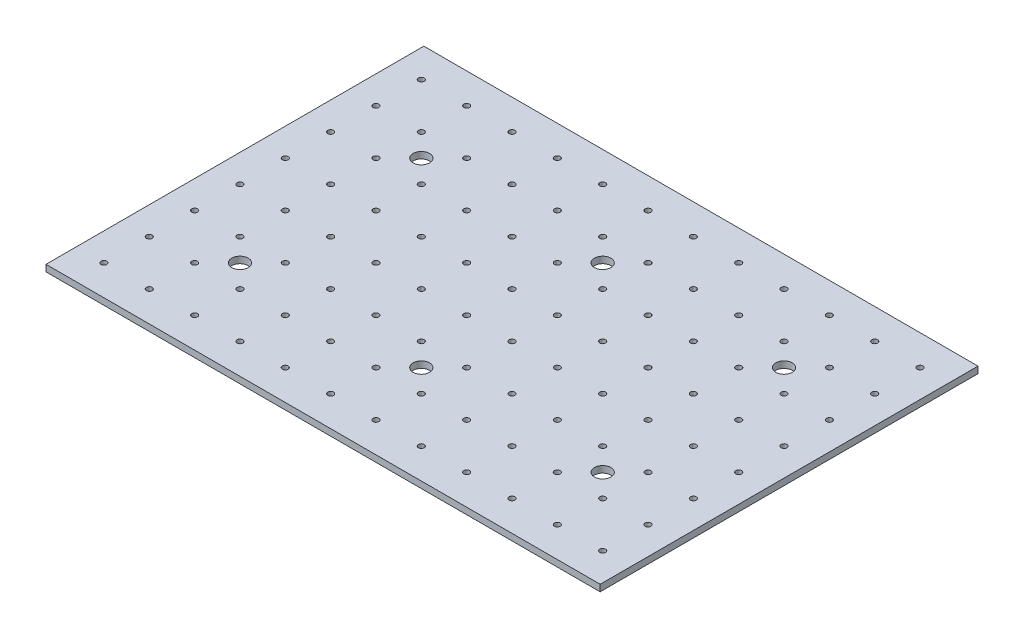
from build123d import *

# Parameters (mm, degrees)
SKETCH1_W                = 110
SKETCH1_H                = 75
BOSS_EXTRUDE1_DEPTH      = 0.65
SKETCH2_R                = 0.575
CUT_EXTRUDE2_DEPTH       = 67.570808167
LPATTERN1_COUNT          = 6
LPATTERN1_PITCH          = 9
LPATTERN1_COUNT_DIR2     = 4
LPATTERN1_PITCH_DIR2     = 9
MIRROR1_COPY_1_SKETCH_R  = 0.575
MIRROR1_COPY_1_DEPTH     = 67.570808167
MIRROR1_COPY_2_SKETCH_R  = 0.575
MIRROR1_COPY_2_DEPTH     = 67.570808167
MIRROR1_COPY_3_SKETCH_R  = 0.575
MIRROR1_COPY_3_DEPTH     = 67.570808167
MIRROR1_COPY_4_SKETCH_R  = 0.575
MIRROR1_COPY_4_DEPTH     = 67.570808167
MIRROR1_COPY_5_SKETCH_R  = 0.575
MIRROR1_COPY_5_DEPTH     = 67.570808167
MIRROR1_COPY_6_SKETCH_R  = 0.575
MIRROR1_COPY_6_DEPTH     = 67.570808167
MIRROR1_COPY_7_SKETCH_R  = 0.575
MIRROR1_COPY_7_DEPTH     = 67.570808167
MIRROR1_COPY_8_SKETCH_R  = 0.575
MIRROR1_COPY_8_DEPTH     = 67.570808167
MIRROR1_COPY_9_SKETCH_R  = 0.575
MIRROR1_COPY_9_DEPTH     = 67.570808167
MIRROR1_COPY_10_SKETCH_R = 0.575
MIRROR1_COPY_10_DEPTH    = 67.570808167
MIRROR1_COPY_11_SKETCH_R = 0.575
MIRROR1_COPY_11_DEPTH    = 67.570808167
MIRROR1_COPY_12_SKETCH_R = 0.575
MIRROR1_COPY_12_DEPTH    = 67.570808167
MIRROR1_COPY_13_SKETCH_R = 0.575
MIRROR1_COPY_13_DEPTH    = 67.570808167
MIRROR1_COPY_14_SKETCH_R = 0.575
MIRROR1_COPY_14_DEPTH    = 67.570808167
MIRROR1_COPY_15_SKETCH_R = 0.575
MIRROR1_COPY_15_DEPTH    = 67.570808167
MIRROR1_COPY_16_SKETCH_R = 0.575
MIRROR1_COPY_16_DEPTH    = 67.570808167
MIRROR1_COPY_17_SKETCH_R = 0.575
MIRROR1_COPY_17_DEPTH    = 67.570808167
MIRROR1_COPY_18_SKETCH_R = 0.575
MIRROR1_COPY_18_DEPTH    = 67.570808167
MIRROR1_COPY_19_SKETCH_R = 0.575
MIRROR1_COPY_19_DEPTH    = 67.570808167
MIRROR1_COPY_20_SKETCH_R = 0.575
MIRROR1_COPY_20_DEPTH    = 67.570808167
MIRROR1_COPY_21_SKETCH_R = 0.575
MIRROR1_COPY_21_DEPTH    = 67.570808167
MIRROR1_COPY_22_SKETCH_R = 0.575
MIRROR1_COPY_22_DEPTH    = 67.570808167
MIRROR1_COPY_23_SKETCH_R = 0.575
MIRROR1_COPY_23_DEPTH    = 67.570808167
MIRROR2_COPY_1_SKETCH_R  = 0.575
MIRROR2_COPY_1_DEPTH     = 67.570808167
MIRROR2_COPY_2_SKETCH_R  = 0.575
MIRROR2_COPY_2_DEPTH     = 67.570808167
MIRROR2_COPY_3_SKETCH_R  = 0.575
MIRROR2_COPY_3_DEPTH     = 67.570808167
MIRROR2_COPY_4_SKETCH_R  = 0.575
MIRROR2_COPY_4_DEPTH     = 67.570808167
MIRROR2_COPY_5_SKETCH_R  = 0.575
MIRROR2_COPY_5_DEPTH     = 67.570808167
MIRROR2_COPY_6_SKETCH_R  = 0.575
MIRROR2_COPY_6_DEPTH     = 67.570808167
MIRROR2_COPY_7_SKETCH_R  = 0.575
MIRROR2_COPY_7_DEPTH     = 67.570808167
MIRROR2_COPY_8_SKETCH_R  = 0.575
MIRROR2_COPY_8_DEPTH     = 67.570808167
MIRROR2_COPY_9_SKETCH_R  = 0.575
MIRROR2_COPY_9_DEPTH     = 67.570808167
MIRROR2_COPY_10_SKETCH_R = 0.575
MIRROR2_COPY_10_DEPTH    = 67.570808167
MIRROR2_COPY_11_SKETCH_R = 0.575
MIRROR2_COPY_11_DEPTH    = 67.570808167
MIRROR2_COPY_12_SKETCH_R = 0.575
MIRROR2_COPY_12_DEPTH    = 67.570808167
MIRROR2_COPY_13_SKETCH_R = 0.575
MIRROR2_COPY_13_DEPTH    = 67.570808167
MIRROR2_COPY_14_SKETCH_R = 0.575
MIRROR2_COPY_14_DEPTH    = 67.570808167
MIRROR2_COPY_15_SKETCH_R = 0.575
MIRROR2_COPY_15_DEPTH    = 67.570808167
MIRROR2_COPY_16_SKETCH_R = 0.575
MIRROR2_COPY_16_DEPTH    = 67.570808167
MIRROR2_COPY_17_SKETCH_R = 0.575
MIRROR2_COPY_17_DEPTH    = 67.570808167
MIRROR2_COPY_18_SKETCH_R = 0.575
MIRROR2_COPY_18_DEPTH    = 67.570808167
MIRROR2_COPY_19_SKETCH_R = 0.575
MIRROR2_COPY_19_DEPTH    = 67.570808167
MIRROR2_COPY_20_SKETCH_R = 0.575
MIRROR2_COPY_20_DEPTH    = 67.570808167
MIRROR2_COPY_21_SKETCH_R = 0.575
MIRROR2_COPY_21_DEPTH    = 67.570808167
MIRROR2_COPY_22_SKETCH_R = 0.575
MIRROR2_COPY_22_DEPTH    = 67.570808167
MIRROR2_COPY_23_SKETCH_R = 0.575
MIRROR2_COPY_23_DEPTH    = 67.570808167
MIRROR2_COPY_24_SKETCH_R = 0.575
MIRROR2_COPY_24_DEPTH    = 67.570808167
MIRROR2_COPY_25_SKETCH_R = 0.575
MIRROR2_COPY_25_DEPTH    = 67.570808167
MIRROR2_COPY_26_SKETCH_R = 0.575
MIRROR2_COPY_26_DEPTH    = 67.570808167
MIRROR2_COPY_27_SKETCH_R = 0.575
MIRROR2_COPY_27_DEPTH    = 67.570808167
MIRROR2_COPY_28_SKETCH_R = 0.575
MIRROR2_COPY_28_DEPTH    = 67.570808167
MIRROR2_COPY_29_SKETCH_R = 0.575
MIRROR2_COPY_29_DEPTH    = 67.570808167
MIRROR2_COPY_30_SKETCH_R = 0.575
MIRROR2_COPY_30_DEPTH    = 67.570808167
MIRROR2_COPY_31_SKETCH_R = 0.575
MIRROR2_COPY_31_DEPTH    = 67.570808167
MIRROR2_COPY_32_SKETCH_R = 0.575
MIRROR2_COPY_32_DEPTH    = 67.570808167
MIRROR2_COPY_33_SKETCH_R = 0.575
MIRROR2_COPY_33_DEPTH    = 67.570808167
MIRROR2_COPY_34_SKETCH_R = 0.575
MIRROR2_COPY_34_DEPTH    = 67.570808167
MIRROR2_COPY_35_SKETCH_R = 0.575
MIRROR2_COPY_35_DEPTH    = 67.570808167
MIRROR2_COPY_36_SKETCH_R = 0.575
MIRROR2_COPY_36_DEPTH    = 67.570808167
MIRROR2_COPY_37_SKETCH_R = 0.575
MIRROR2_COPY_37_DEPTH    = 67.570808167
MIRROR2_COPY_38_SKETCH_R = 0.575
MIRROR2_COPY_38_DEPTH    = 67.570808167
MIRROR2_COPY_39_SKETCH_R = 0.575
MIRROR2_COPY_39_DEPTH    = 67.570808167
MIRROR2_COPY_40_SKETCH_R = 0.575
MIRROR2_COPY_40_DEPTH    = 67.570808167
MIRROR2_COPY_41_SKETCH_R = 0.575
MIRROR2_COPY_41_DEPTH    = 67.570808167
MIRROR2_COPY_42_SKETCH_R = 0.575
MIRROR2_COPY_42_DEPTH    = 67.570808167
MIRROR2_COPY_43_SKETCH_R = 0.575
MIRROR2_COPY_43_DEPTH    = 67.570808167
MIRROR2_COPY_44_SKETCH_R = 0.575
MIRROR2_COPY_44_DEPTH    = 67.570808167
MIRROR2_COPY_45_SKETCH_R = 0.575
MIRROR2_COPY_45_DEPTH    = 67.570808167
MIRROR2_COPY_46_SKETCH_R = 0.575
MIRROR2_COPY_46_DEPTH    = 67.570808167
MIRROR2_COPY_47_SKETCH_R = 0.575
MIRROR2_COPY_47_DEPTH    = 67.570808167
F_4_CLEARANCE_HOLE1_D    = 3.2639


with BuildPart() as part:
    # Sketch1 → Boss-Extrude1 (new, symmetric)
    with BuildSketch(Plane(origin=(0, 0, 0), x_dir=(1, 0, 0), z_dir=(0, 1, 0))):
        Rectangle(SKETCH1_W, SKETCH1_H)
    extrude(amount=BOSS_EXTRUDE1_DEPTH, both=True)

    # Sketch2 → Cut-Extrude2 (cut, symmetric)
    with BuildSketch(Plane(origin=(0, 0, 0), x_dir=(1, 0, 0), z_dir=(0, 1, 0))):
        with Locations((-4.5, 4.5)):
            Circle(SKETCH2_R)
    cut_extrude2 = extrude(amount=CUT_EXTRUDE2_DEPTH, both=True, mode=Mode.SUBTRACT)

    # LPattern1: Cut-Extrude2 6 × 4
    with Locations(*[(-i * LPATTERN1_PITCH, 0, -j * LPATTERN1_PITCH_DIR2) for i in range(LPATTERN1_COUNT) for j in range(LPATTERN1_COUNT_DIR2) if (i, j) != (0, 0)]):
        add(cut_extrude2, mode=Mode.SUBTRACT)

    # Mirror1: Cut-Extrude2 across plane
    add(cut_extrude2.mirror(Plane.XY), mode=Mode.SUBTRACT)

    # Mirror1 copy 1 sketch → Mirror1 copy 1 (cut, symmetric)
    with BuildSketch(Plane(origin=(0, 0, 9), x_dir=(1, 0, 0), z_dir=(0, 1, 0))):
        with Locations((-4.5, -4.5)):
            Circle(MIRROR1_COPY_1_SKETCH_R)
    extrude(amount=MIRROR1_COPY_1_DEPTH, both=True, mode=Mode.SUBTRACT)

    # Mirror1 copy 2 sketch → Mirror1 copy 2 (cut, symmetric)
    with BuildSketch(Plane(origin=(0, 0, 18), x_dir=(1, 0, 0), z_dir=(0, 1, 0))):
        with Locations((-4.5, -4.5)):
            Circle(MIRROR1_COPY_2_SKETCH_R)
    extrude(amount=MIRROR1_COPY_2_DEPTH, both=True, mode=Mode.SUBTRACT)

    # Mirror1 copy 3 sketch → Mirror1 copy 3 (cut, symmetric)
    with BuildSketch(Plane(origin=(0, 0, 27), x_dir=(1, 0, 0), z_dir=(0, 1, 0))):
        with Locations((-4.5, -4.5)):
            Circle(MIRROR1_COPY_3_SKETCH_R)
    extrude(amount=MIRROR1_COPY_3_DEPTH, both=True, mode=Mode.SUBTRACT)

    # Mirror1 copy 4 sketch → Mirror1 copy 4 (cut, symmetric)
    with BuildSketch(Plane(origin=(-9, 0, 0), x_dir=(1, 0, 0), z_dir=(0, 1, 0))):
        with Locations((-4.5, -4.5)):
            Circle(MIRROR1_COPY_4_SKETCH_R)
    extrude(amount=MIRROR1_COPY_4_DEPTH, both=True, mode=Mode.SUBTRACT)

    # Mirror1 copy 5 sketch → Mirror1 copy 5 (cut, symmetric)
    with BuildSketch(Plane(origin=(-9, 0, 9), x_dir=(1, 0, 0), z_dir=(0, 1, 0))):
        with Locations((-4.5, -4.5)):
            Circle(MIRROR1_COPY_5_SKETCH_R)
    extrude(amount=MIRROR1_COPY_5_DEPTH, both=True, mode=Mode.SUBTRACT)

    # Mirror1 copy 6 sketch → Mirror1 copy 6 (cut, symmetric)
    with BuildSketch(Plane(origin=(-9, 0, 18), x_dir=(1, 0, 0), z_dir=(0, 1, 0))):
        with Locations((-4.5, -4.5)):
            Circle(MIRROR1_COPY_6_SKETCH_R)
    extrude(amount=MIRROR1_COPY_6_DEPTH, both=True, mode=Mode.SUBTRACT)

    # Mirror1 copy 7 sketch → Mirror1 copy 7 (cut, symmetric)
    with BuildSketch(Plane(origin=(-9, 0, 27), x_dir=(1, 0, 0), z_dir=(0, 1, 0))):
        with Locations((-4.5, -4.5)):
            Circle(MIRROR1_COPY_7_SKETCH_R)
    extrude(amount=MIRROR1_COPY_7_DEPTH, both=True, mode=Mode.SUBTRACT)

    # Mirror1 copy 8 sketch → Mirror1 copy 8 (cut, symmetric)
    with BuildSketch(Plane(origin=(-18, 0, 0), x_dir=(1, 0, 0), z_dir=(0, 1, 0))):
        with Locations((-4.5, -4.5)):
            Circle(MIRROR1_COPY_8_SKETCH_R)
    extrude(amount=MIRROR1_COPY_8_DEPTH, both=True, mode=Mode.SUBTRACT)

    # Mirror1 copy 9 sketch → Mirror1 copy 9 (cut, symmetric)
    with BuildSketch(Plane(origin=(-18, 0, 9), x_dir=(1, 0, 0), z_dir=(0, 1, 0))):
        with Locations((-4.5, -4.5)):
            Circle(MIRROR1_COPY_9_SKETCH_R)
    extrude(amount=MIRROR1_COPY_9_DEPTH, both=True, mode=Mode.SUBTRACT)

    # Mirror1 copy 10 sketch → Mirror1 copy 10 (cut, symmetric)
    with BuildSketch(Plane(origin=(-18, 0, 18), x_dir=(1, 0, 0), z_dir=(0, 1, 0))):
        with Locations((-4.5, -4.5)):
            Circle(MIRROR1_COPY_10_SKETCH_R)
    extrude(amount=MIRROR1_COPY_10_DEPTH, both=True, mode=Mode.SUBTRACT)

    # Mirror1 copy 11 sketch → Mirror1 copy 11 (cut, symmetric)
    with BuildSketch(Plane(origin=(-18, 0, 27), x_dir=(1, 0, 0), z_dir=(0, 1, 0))):
        with Locations((-4.5, -4.5)):
            Circle(MIRROR1_COPY_11_SKETCH_R)
    extrude(amount=MIRROR1_COPY_11_DEPTH, both=True, mode=Mode.SUBTRACT)

    # Mirror1 copy 12 sketch → Mirror1 copy 12 (cut, symmetric)
    with BuildSketch(Plane(origin=(-27, 0, 0), x_dir=(1, 0, 0), z_dir=(0, 1, 0))):
        with Locations((-4.5, -4.5)):
            Circle(MIRROR1_COPY_12_SKETCH_R)
    extrude(amount=MIRROR1_COPY_12_DEPTH, both=True, mode=Mode.SUBTRACT)

    # Mirror1 copy 13 sketch → Mirror1 copy 13 (cut, symmetric)
    with BuildSketch(Plane(origin=(-27, 0, 9), x_dir=(1, 0, 0), z_dir=(0, 1, 0))):
        with Locations((-4.5, -4.5)):
            Circle(MIRROR1_COPY_13_SKETCH_R)
    extrude(amount=MIRROR1_COPY_13_DEPTH, both=True, mode=Mode.SUBTRACT)

    # Mirror1 copy 14 sketch → Mirror1 copy 14 (cut, symmetric)
    with BuildSketch(Plane(origin=(-27, 0, 18), x_dir=(1, 0, 0), z_dir=(0, 1, 0))):
        with Locations((-4.5, -4.5)):
            Circle(MIRROR1_COPY_14_SKETCH_R)
    extrude(amount=MIRROR1_COPY_14_DEPTH, both=True, mode=Mode.SUBTRACT)

    # Mirror1 copy 15 sketch → Mirror1 copy 15 (cut, symmetric)
    with BuildSketch(Plane(origin=(-27, 0, 27), x_dir=(1, 0, 0), z_dir=(0, 1, 0))):
        with Locations((-4.5, -4.5)):
            Circle(MIRROR1_COPY_15_SKETCH_R)
    extrude(amount=MIRROR1_COPY_15_DEPTH, both=True, mode=Mode.SUBTRACT)

    # Mirror1 copy 16 sketch → Mirror1 copy 16 (cut, symmetric)
    with BuildSketch(Plane(origin=(-36, 0, 0), x_dir=(1, 0, 0), z_dir=(0, 1, 0))):
        with Locations((-4.5, -4.5)):
            Circle(MIRROR1_COPY_16_SKETCH_R)
    extrude(amount=MIRROR1_COPY_16_DEPTH, both=True, mode=Mode.SUBTRACT)

    # Mirror1 copy 17 sketch → Mirror1 copy 17 (cut, symmetric)
    with BuildSketch(Plane(origin=(-36, 0, 9), x_dir=(1, 0, 0), z_dir=(0, 1, 0))):
        with Locations((-4.5, -4.5)):
            Circle(MIRROR1_COPY_17_SKETCH_R)
    extrude(amount=MIRROR1_COPY_17_DEPTH, both=True, mode=Mode.SUBTRACT)

    # Mirror1 copy 18 sketch → Mirror1 copy 18 (cut, symmetric)
    with BuildSketch(Plane(origin=(-36, 0, 18), x_dir=(1, 0, 0), z_dir=(0, 1, 0))):
        with Locations((-4.5, -4.5)):
            Circle(MIRROR1_COPY_18_SKETCH_R)
    extrude(amount=MIRROR1_COPY_18_DEPTH, both=True, mode=Mode.SUBTRACT)

    # Mirror1 copy 19 sketch → Mirror1 copy 19 (cut, symmetric)
    with BuildSketch(Plane(origin=(-36, 0, 27), x_dir=(1, 0, 0), z_dir=(0, 1, 0))):
        with Locations((-4.5, -4.5)):
            Circle(MIRROR1_COPY_19_SKETCH_R)
    extrude(amount=MIRROR1_COPY_19_DEPTH, both=True, mode=Mode.SUBTRACT)

    # Mirror1 copy 20 sketch → Mirror1 copy 20 (cut, symmetric)
    with BuildSketch(Plane(origin=(-45, 0, 0), x_dir=(1, 0, 0), z_dir=(0, 1, 0))):
        with Locations((-4.5, -4.5)):
            Circle(MIRROR1_COPY_20_SKETCH_R)
    extrude(amount=MIRROR1_COPY_20_DEPTH, both=True, mode=Mode.SUBTRACT)

    # Mirror1 copy 21 sketch → Mirror1 copy 21 (cut, symmetric)
    with BuildSketch(Plane(origin=(-45, 0, 9), x_dir=(1, 0, 0), z_dir=(0, 1, 0))):
        with Locations((-4.5, -4.5)):
            Circle(MIRROR1_COPY_21_SKETCH_R)
    extrude(amount=MIRROR1_COPY_21_DEPTH, both=True, mode=Mode.SUBTRACT)

    # Mirror1 copy 22 sketch → Mirror1 copy 22 (cut, symmetric)
    with BuildSketch(Plane(origin=(-45, 0, 18), x_dir=(1, 0, 0), z_dir=(0, 1, 0))):
        with Locations((-4.5, -4.5)):
            Circle(MIRROR1_COPY_22_SKETCH_R)
    extrude(amount=MIRROR1_COPY_22_DEPTH, both=True, mode=Mode.SUBTRACT)

    # Mirror1 copy 23 sketch → Mirror1 copy 23 (cut, symmetric)
    with BuildSketch(Plane(origin=(-45, 0, 27), x_dir=(1, 0, 0), z_dir=(0, 1, 0))):
        with Locations((-4.5, -4.5)):
            Circle(MIRROR1_COPY_23_SKETCH_R)
    extrude(amount=MIRROR1_COPY_23_DEPTH, both=True, mode=Mode.SUBTRACT)

    # Mirror2: Cut-Extrude2 across plane
    add(cut_extrude2.mirror(Plane(origin=(0, 0, 0), x_dir=(0, 0, 1), z_dir=(1, 0, 0))), mode=Mode.SUBTRACT)

    # Mirror2 copy 1 sketch → Mirror2 copy 1 (cut, symmetric)
    with BuildSketch(Plane(origin=(0, 0, -9), x_dir=(-1, 0, 0), z_dir=(0, 1, 0))):
        with Locations((-4.5, -4.5)):
            Circle(MIRROR2_COPY_1_SKETCH_R)
    extrude(amount=MIRROR2_COPY_1_DEPTH, both=True, mode=Mode.SUBTRACT)

    # Mirror2 copy 2 sketch → Mirror2 copy 2 (cut, symmetric)
    with BuildSketch(Plane(origin=(0, 0, -18), x_dir=(-1, 0, 0), z_dir=(0, 1, 0))):
        with Locations((-4.5, -4.5)):
            Circle(MIRROR2_COPY_2_SKETCH_R)
    extrude(amount=MIRROR2_COPY_2_DEPTH, both=True, mode=Mode.SUBTRACT)

    # Mirror2 copy 3 sketch → Mirror2 copy 3 (cut, symmetric)
    with BuildSketch(Plane(origin=(0, 0, -27), x_dir=(-1, 0, 0), z_dir=(0, 1, 0))):
        with Locations((-4.5, -4.5)):
            Circle(MIRROR2_COPY_3_SKETCH_R)
    extrude(amount=MIRROR2_COPY_3_DEPTH, both=True, mode=Mode.SUBTRACT)

    # Mirror2 copy 4 sketch → Mirror2 copy 4 (cut, symmetric)
    with BuildSketch(Plane(origin=(9, 0, 0), x_dir=(-1, 0, 0), z_dir=(0, 1, 0))):
        with Locations((-4.5, -4.5)):
            Circle(MIRROR2_COPY_4_SKETCH_R)
    extrude(amount=MIRROR2_COPY_4_DEPTH, both=True, mode=Mode.SUBTRACT)

    # Mirror2 copy 5 sketch → Mirror2 copy 5 (cut, symmetric)
    with BuildSketch(Plane(origin=(9, 0, -9), x_dir=(-1, 0, 0), z_dir=(0, 1, 0))):
        with Locations((-4.5, -4.5)):
            Circle(MIRROR2_COPY_5_SKETCH_R)
    extrude(amount=MIRROR2_COPY_5_DEPTH, both=True, mode=Mode.SUBTRACT)

    # Mirror2 copy 6 sketch → Mirror2 copy 6 (cut, symmetric)
    with BuildSketch(Plane(origin=(9, 0, -18), x_dir=(-1, 0, 0), z_dir=(0, 1, 0))):
        with Locations((-4.5, -4.5)):
            Circle(MIRROR2_COPY_6_SKETCH_R)
    extrude(amount=MIRROR2_COPY_6_DEPTH, both=True, mode=Mode.SUBTRACT)

    # Mirror2 copy 7 sketch → Mirror2 copy 7 (cut, symmetric)
    with BuildSketch(Plane(origin=(9, 0, -27), x_dir=(-1, 0, 0), z_dir=(0, 1, 0))):
        with Locations((-4.5, -4.5)):
            Circle(MIRROR2_COPY_7_SKETCH_R)
    extrude(amount=MIRROR2_COPY_7_DEPTH, both=True, mode=Mode.SUBTRACT)

    # Mirror2 copy 8 sketch → Mirror2 copy 8 (cut, symmetric)
    with BuildSketch(Plane(origin=(18, 0, 0), x_dir=(-1, 0, 0), z_dir=(0, 1, 0))):
        with Locations((-4.5, -4.5)):
            Circle(MIRROR2_COPY_8_SKETCH_R)
    extrude(amount=MIRROR2_COPY_8_DEPTH, both=True, mode=Mode.SUBTRACT)

    # Mirror2 copy 9 sketch → Mirror2 copy 9 (cut, symmetric)
    with BuildSketch(Plane(origin=(18, 0, -9), x_dir=(-1, 0, 0), z_dir=(0, 1, 0))):
        with Locations((-4.5, -4.5)):
            Circle(MIRROR2_COPY_9_SKETCH_R)
    extrude(amount=MIRROR2_COPY_9_DEPTH, both=True, mode=Mode.SUBTRACT)

    # Mirror2 copy 10 sketch → Mirror2 copy 10 (cut, symmetric)
    with BuildSketch(Plane(origin=(18, 0, -18), x_dir=(-1, 0, 0), z_dir=(0, 1, 0))):
        with Locations((-4.5, -4.5)):
            Circle(MIRROR2_COPY_10_SKETCH_R)
    extrude(amount=MIRROR2_COPY_10_DEPTH, both=True, mode=Mode.SUBTRACT)

    # Mirror2 copy 11 sketch → Mirror2 copy 11 (cut, symmetric)
    with BuildSketch(Plane(origin=(18, 0, -27), x_dir=(-1, 0, 0), z_dir=(0, 1, 0))):
        with Locations((-4.5, -4.5)):
            Circle(MIRROR2_COPY_11_SKETCH_R)
    extrude(amount=MIRROR2_COPY_11_DEPTH, both=True, mode=Mode.SUBTRACT)

    # Mirror2 copy 12 sketch → Mirror2 copy 12 (cut, symmetric)
    with BuildSketch(Plane(origin=(27, 0, 0), x_dir=(-1, 0, 0), z_dir=(0, 1, 0))):
        with Locations((-4.5, -4.5)):
            Circle(MIRROR2_COPY_12_SKETCH_R)
    extrude(amount=MIRROR2_COPY_12_DEPTH, both=True, mode=Mode.SUBTRACT)

    # Mirror2 copy 13 sketch → Mirror2 copy 13 (cut, symmetric)
    with BuildSketch(Plane(origin=(27, 0, -9), x_dir=(-1, 0, 0), z_dir=(0, 1, 0))):
        with Locations((-4.5, -4.5)):
            Circle(MIRROR2_COPY_13_SKETCH_R)
    extrude(amount=MIRROR2_COPY_13_DEPTH, both=True, mode=Mode.SUBTRACT)

    # Mirror2 copy 14 sketch → Mirror2 copy 14 (cut, symmetric)
    with BuildSketch(Plane(origin=(27, 0, -18), x_dir=(-1, 0, 0), z_dir=(0, 1, 0))):
        with Locations((-4.5, -4.5)):
            Circle(MIRROR2_COPY_14_SKETCH_R)
    extrude(amount=MIRROR2_COPY_14_DEPTH, both=True, mode=Mode.SUBTRACT)

    # Mirror2 copy 15 sketch → Mirror2 copy 15 (cut, symmetric)
    with BuildSketch(Plane(origin=(27, 0, -27), x_dir=(-1, 0, 0), z_dir=(0, 1, 0))):
        with Locations((-4.5, -4.5)):
            Circle(MIRROR2_COPY_15_SKETCH_R)
    extrude(amount=MIRROR2_COPY_15_DEPTH, both=True, mode=Mode.SUBTRACT)

    # Mirror2 copy 16 sketch → Mirror2 copy 16 (cut, symmetric)
    with BuildSketch(Plane(origin=(36, 0, 0), x_dir=(-1, 0, 0), z_dir=(0, 1, 0))):
        with Locations((-4.5, -4.5)):
            Circle(MIRROR2_COPY_16_SKETCH_R)
    extrude(amount=MIRROR2_COPY_16_DEPTH, both=True, mode=Mode.SUBTRACT)

    # Mirror2 copy 17 sketch → Mirror2 copy 17 (cut, symmetric)
    with BuildSketch(Plane(origin=(36, 0, -9), x_dir=(-1, 0, 0), z_dir=(0, 1, 0))):
        with Locations((-4.5, -4.5)):
            Circle(MIRROR2_COPY_17_SKETCH_R)
    extrude(amount=MIRROR2_COPY_17_DEPTH, both=True, mode=Mode.SUBTRACT)

    # Mirror2 copy 18 sketch → Mirror2 copy 18 (cut, symmetric)
    with BuildSketch(Plane(origin=(36, 0, -18), x_dir=(-1, 0, 0), z_dir=(0, 1, 0))):
        with Locations((-4.5, -4.5)):
            Circle(MIRROR2_COPY_18_SKETCH_R)
    extrude(amount=MIRROR2_COPY_18_DEPTH, both=True, mode=Mode.SUBTRACT)

    # Mirror2 copy 19 sketch → Mirror2 copy 19 (cut, symmetric)
    with BuildSketch(Plane(origin=(36, 0, -27), x_dir=(-1, 0, 0), z_dir=(0, 1, 0))):
        with Locations((-4.5, -4.5)):
            Circle(MIRROR2_COPY_19_SKETCH_R)
    extrude(amount=MIRROR2_COPY_19_DEPTH, both=True, mode=Mode.SUBTRACT)

    # Mirror2 copy 20 sketch → Mirror2 copy 20 (cut, symmetric)
    with BuildSketch(Plane(origin=(45, 0, 0), x_dir=(-1, 0, 0), z_dir=(0, 1, 0))):
        with Locations((-4.5, -4.5)):
            Circle(MIRROR2_COPY_20_SKETCH_R)
    extrude(amount=MIRROR2_COPY_20_DEPTH, both=True, mode=Mode.SUBTRACT)

    # Mirror2 copy 21 sketch → Mirror2 copy 21 (cut, symmetric)
    with BuildSketch(Plane(origin=(45, 0, -9), x_dir=(-1, 0, 0), z_dir=(0, 1, 0))):
        with Locations((-4.5, -4.5)):
            Circle(MIRROR2_COPY_21_SKETCH_R)
    extrude(amount=MIRROR2_COPY_21_DEPTH, both=True, mode=Mode.SUBTRACT)

    # Mirror2 copy 22 sketch → Mirror2 copy 22 (cut, symmetric)
    with BuildSketch(Plane(origin=(45, 0, -18), x_dir=(-1, 0, 0), z_dir=(0, 1, 0))):
        with Locations((-4.5, -4.5)):
            Circle(MIRROR2_COPY_22_SKETCH_R)
    extrude(amount=MIRROR2_COPY_22_DEPTH, both=True, mode=Mode.SUBTRACT)

    # Mirror2 copy 23 sketch → Mirror2 copy 23 (cut, symmetric)
    with BuildSketch(Plane(origin=(45, 0, -27), x_dir=(-1, 0, 0), z_dir=(0, 1, 0))):
        with Locations((-4.5, -4.5)):
            Circle(MIRROR2_COPY_23_SKETCH_R)
    extrude(amount=MIRROR2_COPY_23_DEPTH, both=True, mode=Mode.SUBTRACT)

    # Mirror2 copy 24 sketch → Mirror2 copy 24 (cut, symmetric)
    with BuildSketch(Plane(origin=(0, 0, 0), x_dir=(-1, 0, 0), z_dir=(0, 1, 0))):
        with Locations((-4.5, 4.5)):
            Circle(MIRROR2_COPY_24_SKETCH_R)
    extrude(amount=MIRROR2_COPY_24_DEPTH, both=True, mode=Mode.SUBTRACT)

    # Mirror2 copy 25 sketch → Mirror2 copy 25 (cut, symmetric)
    with BuildSketch(Plane(origin=(0, 0, 9), x_dir=(-1, 0, 0), z_dir=(0, 1, 0))):
        with Locations((-4.5, 4.5)):
            Circle(MIRROR2_COPY_25_SKETCH_R)
    extrude(amount=MIRROR2_COPY_25_DEPTH, both=True, mode=Mode.SUBTRACT)

    # Mirror2 copy 26 sketch → Mirror2 copy 26 (cut, symmetric)
    with BuildSketch(Plane(origin=(0, 0, 18), x_dir=(-1, 0, 0), z_dir=(0, 1, 0))):
        with Locations((-4.5, 4.5)):
            Circle(MIRROR2_COPY_26_SKETCH_R)
    extrude(amount=MIRROR2_COPY_26_DEPTH, both=True, mode=Mode.SUBTRACT)

    # Mirror2 copy 27 sketch → Mirror2 copy 27 (cut, symmetric)
    with BuildSketch(Plane(origin=(0, 0, 27), x_dir=(-1, 0, 0), z_dir=(0, 1, 0))):
        with Locations((-4.5, 4.5)):
            Circle(MIRROR2_COPY_27_SKETCH_R)
    extrude(amount=MIRROR2_COPY_27_DEPTH, both=True, mode=Mode.SUBTRACT)

    # Mirror2 copy 28 sketch → Mirror2 copy 28 (cut, symmetric)
    with BuildSketch(Plane(origin=(9, 0, 0), x_dir=(-1, 0, 0), z_dir=(0, 1, 0))):
        with Locations((-4.5, 4.5)):
            Circle(MIRROR2_COPY_28_SKETCH_R)
    extrude(amount=MIRROR2_COPY_28_DEPTH, both=True, mode=Mode.SUBTRACT)

    # Mirror2 copy 29 sketch → Mirror2 copy 29 (cut, symmetric)
    with BuildSketch(Plane(origin=(9, 0, 9), x_dir=(-1, 0, 0), z_dir=(0, 1, 0))):
        with Locations((-4.5, 4.5)):
            Circle(MIRROR2_COPY_29_SKETCH_R)
    extrude(amount=MIRROR2_COPY_29_DEPTH, both=True, mode=Mode.SUBTRACT)

    # Mirror2 copy 30 sketch → Mirror2 copy 30 (cut, symmetric)
    with BuildSketch(Plane(origin=(9, 0, 18), x_dir=(-1, 0, 0), z_dir=(0, 1, 0))):
        with Locations((-4.5, 4.5)):
            Circle(MIRROR2_COPY_30_SKETCH_R)
    extrude(amount=MIRROR2_COPY_30_DEPTH, both=True, mode=Mode.SUBTRACT)

    # Mirror2 copy 31 sketch → Mirror2 copy 31 (cut, symmetric)
    with BuildSketch(Plane(origin=(9, 0, 27), x_dir=(-1, 0, 0), z_dir=(0, 1, 0))):
        with Locations((-4.5, 4.5)):
            Circle(MIRROR2_COPY_31_SKETCH_R)
    extrude(amount=MIRROR2_COPY_31_DEPTH, both=True, mode=Mode.SUBTRACT)

    # Mirror2 copy 32 sketch → Mirror2 copy 32 (cut, symmetric)
    with BuildSketch(Plane(origin=(18, 0, 0), x_dir=(-1, 0, 0), z_dir=(0, 1, 0))):
        with Locations((-4.5, 4.5)):
            Circle(MIRROR2_COPY_32_SKETCH_R)
    extrude(amount=MIRROR2_COPY_32_DEPTH, both=True, mode=Mode.SUBTRACT)

    # Mirror2 copy 33 sketch → Mirror2 copy 33 (cut, symmetric)
    with BuildSketch(Plane(origin=(18, 0, 9), x_dir=(-1, 0, 0), z_dir=(0, 1, 0))):
        with Locations((-4.5, 4.5)):
            Circle(MIRROR2_COPY_33_SKETCH_R)
    extrude(amount=MIRROR2_COPY_33_DEPTH, both=True, mode=Mode.SUBTRACT)

    # Mirror2 copy 34 sketch → Mirror2 copy 34 (cut, symmetric)
    with BuildSketch(Plane(origin=(18, 0, 18), x_dir=(-1, 0, 0), z_dir=(0, 1, 0))):
        with Locations((-4.5, 4.5)):
            Circle(MIRROR2_COPY_34_SKETCH_R)
    extrude(amount=MIRROR2_COPY_34_DEPTH, both=True, mode=Mode.SUBTRACT)

    # Mirror2 copy 35 sketch → Mirror2 copy 35 (cut, symmetric)
    with BuildSketch(Plane(origin=(18, 0, 27), x_dir=(-1, 0, 0), z_dir=(0, 1, 0))):
        with Locations((-4.5, 4.5)):
            Circle(MIRROR2_COPY_35_SKETCH_R)
    extrude(amount=MIRROR2_COPY_35_DEPTH, both=True, mode=Mode.SUBTRACT)

    # Mirror2 copy 36 sketch → Mirror2 copy 36 (cut, symmetric)
    with BuildSketch(Plane(origin=(27, 0, 0), x_dir=(-1, 0, 0), z_dir=(0, 1, 0))):
        with Locations((-4.5, 4.5)):
            Circle(MIRROR2_COPY_36_SKETCH_R)
    extrude(amount=MIRROR2_COPY_36_DEPTH, both=True, mode=Mode.SUBTRACT)

    # Mirror2 copy 37 sketch → Mirror2 copy 37 (cut, symmetric)
    with BuildSketch(Plane(origin=(27, 0, 9), x_dir=(-1, 0, 0), z_dir=(0, 1, 0))):
        with Locations((-4.5, 4.5)):
            Circle(MIRROR2_COPY_37_SKETCH_R)
    extrude(amount=MIRROR2_COPY_37_DEPTH, both=True, mode=Mode.SUBTRACT)

    # Mirror2 copy 38 sketch → Mirror2 copy 38 (cut, symmetric)
    with BuildSketch(Plane(origin=(27, 0, 18), x_dir=(-1, 0, 0), z_dir=(0, 1, 0))):
        with Locations((-4.5, 4.5)):
            Circle(MIRROR2_COPY_38_SKETCH_R)
    extrude(amount=MIRROR2_COPY_38_DEPTH, both=True, mode=Mode.SUBTRACT)

    # Mirror2 copy 39 sketch → Mirror2 copy 39 (cut, symmetric)
    with BuildSketch(Plane(origin=(27, 0, 27), x_dir=(-1, 0, 0), z_dir=(0, 1, 0))):
        with Locations((-4.5, 4.5)):
            Circle(MIRROR2_COPY_39_SKETCH_R)
    extrude(amount=MIRROR2_COPY_39_DEPTH, both=True, mode=Mode.SUBTRACT)

    # Mirror2 copy 40 sketch → Mirror2 copy 40 (cut, symmetric)
    with BuildSketch(Plane(origin=(36, 0, 0), x_dir=(-1, 0, 0), z_dir=(0, 1, 0))):
        with Locations((-4.5, 4.5)):
            Circle(MIRROR2_COPY_40_SKETCH_R)
    extrude(amount=MIRROR2_COPY_40_DEPTH, both=True, mode=Mode.SUBTRACT)

    # Mirror2 copy 41 sketch → Mirror2 copy 41 (cut, symmetric)
    with BuildSketch(Plane(origin=(36, 0, 9), x_dir=(-1, 0, 0), z_dir=(0, 1, 0))):
        with Locations((-4.5, 4.5)):
            Circle(MIRROR2_COPY_41_SKETCH_R)
    extrude(amount=MIRROR2_COPY_41_DEPTH, both=True, mode=Mode.SUBTRACT)

    # Mirror2 copy 42 sketch → Mirror2 copy 42 (cut, symmetric)
    with BuildSketch(Plane(origin=(36, 0, 18), x_dir=(-1, 0, 0), z_dir=(0, 1, 0))):
        with Locations((-4.5, 4.5)):
            Circle(MIRROR2_COPY_42_SKETCH_R)
    extrude(amount=MIRROR2_COPY_42_DEPTH, both=True, mode=Mode.SUBTRACT)

    # Mirror2 copy 43 sketch → Mirror2 copy 43 (cut, symmetric)
    with BuildSketch(Plane(origin=(36, 0, 27), x_dir=(-1, 0, 0), z_dir=(0, 1, 0))):
        with Locations((-4.5, 4.5)):
            Circle(MIRROR2_COPY_43_SKETCH_R)
    extrude(amount=MIRROR2_COPY_43_DEPTH, both=True, mode=Mode.SUBTRACT)

    # Mirror2 copy 44 sketch → Mirror2 copy 44 (cut, symmetric)
    with BuildSketch(Plane(origin=(45, 0, 0), x_dir=(-1, 0, 0), z_dir=(0, 1, 0))):
        with Locations((-4.5, 4.5)):
            Circle(MIRROR2_COPY_44_SKETCH_R)
    extrude(amount=MIRROR2_COPY_44_DEPTH, both=True, mode=Mode.SUBTRACT)

    # Mirror2 copy 45 sketch → Mirror2 copy 45 (cut, symmetric)
    with BuildSketch(Plane(origin=(45, 0, 9), x_dir=(-1, 0, 0), z_dir=(0, 1, 0))):
        with Locations((-4.5, 4.5)):
            Circle(MIRROR2_COPY_45_SKETCH_R)
    extrude(amount=MIRROR2_COPY_45_DEPTH, both=True, mode=Mode.SUBTRACT)

    # Mirror2 copy 46 sketch → Mirror2 copy 46 (cut, symmetric)
    with BuildSketch(Plane(origin=(45, 0, 18), x_dir=(-1, 0, 0), z_dir=(0, 1, 0))):
        with Locations((-4.5, 4.5)):
            Circle(MIRROR2_COPY_46_SKETCH_R)
    extrude(amount=MIRROR2_COPY_46_DEPTH, both=True, mode=Mode.SUBTRACT)

    # Mirror2 copy 47 sketch → Mirror2 copy 47 (cut, symmetric)
    with BuildSketch(Plane(origin=(45, 0, 27), x_dir=(-1, 0, 0), z_dir=(0, 1, 0))):
        with Locations((-4.5, 4.5)):
            Circle(MIRROR2_COPY_47_SKETCH_R)
    extrude(amount=MIRROR2_COPY_47_DEPTH, both=True, mode=Mode.SUBTRACT)

    # #4 Clearance Hole1 (through all)
    with Locations(Plane(origin=(0, 0.65, 0), x_dir=(1, 0, 0), z_dir=(0, 1, 0))):
        with Locations((-36, 18), (36, -18), (36, 18), (-36, -18), (0, 18), (0, -18)):
            Hole(F_4_CLEARANCE_HOLE1_D / 2)


solid = part.part
